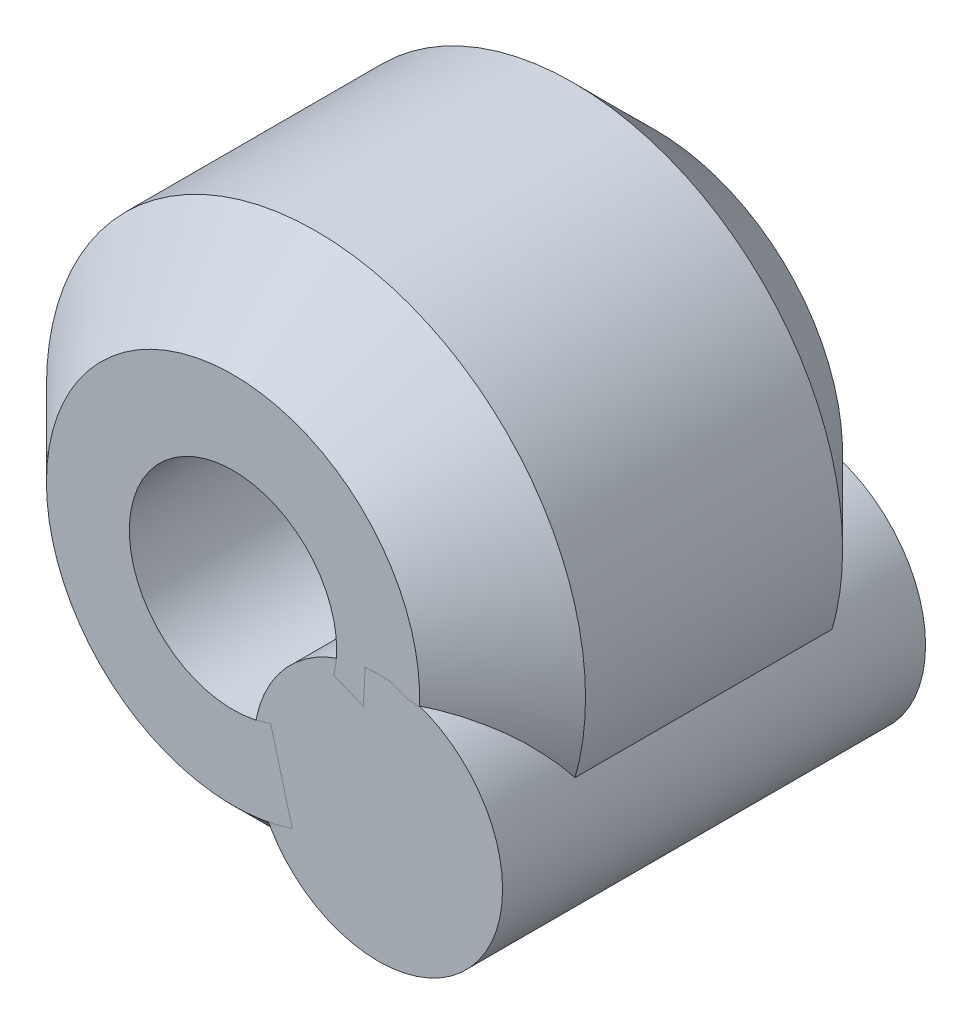
from build123d import *

# Parameters (mm, degrees)
BOSS_EXTRUDE1_DEPTH      = 5.1
BOSS_EXTRUDE1_DEPTH_BACK = 5.1
SKETCH3_R                = 3
CUT_EXTRUDE1_DEPTH       = 23.566789758
CUT_EXTRUDE1_DEPTH_BACK  = 23.566789758
SKETCH7_R                = 2.5


with BuildPart() as part:
    # Sketch3 → Boss-Extrude1 (new, two sides: drawn at the far end of the back side and taken through both)
    with BuildSketch(Plane.XY.offset(-BOSS_EXTRUDE1_DEPTH_BACK)):
        with Locations((-11, -3)):
            Circle(SKETCH3_R)
    extrude(amount=BOSS_EXTRUDE1_DEPTH + BOSS_EXTRUDE1_DEPTH_BACK)


with BuildPart() as body_2:
    # Sketch1 → Revolve1 (revolve)
    with BuildSketch(Plane(origin=(0, 0, 0), x_dir=(1, 0, 0), z_dir=(0, 1, 0)), mode=Mode.PRIVATE) as revolve1_sk:
        Polygon((-8, -3.1), (-10, -5.1), (-14.5, -5.1), (-14.5, 5.1), (-10, 5.1), (-8, 3.1), align=None)
    revolve(revolve1_sk.sketch.rotate(Axis((-14.5, 0, -5.1), (0, 0, 1)), 180), axis=Axis((-14.5, 0, -5.1), (0, 0, 1)))

    # Sketch7 → Cut-Extrude1 (cut, two sides: drawn at the far end of the back side and taken through both)
    with BuildSketch(Plane.XY.offset(-CUT_EXTRUDE1_DEPTH_BACK)):
        with Locations((-14.5, 0)):
            Circle(SKETCH7_R)
    extrude(amount=CUT_EXTRUDE1_DEPTH + CUT_EXTRUDE1_DEPTH_BACK, mode=Mode.SUBTRACT)


solid = Compound([part.part, body_2.part])
